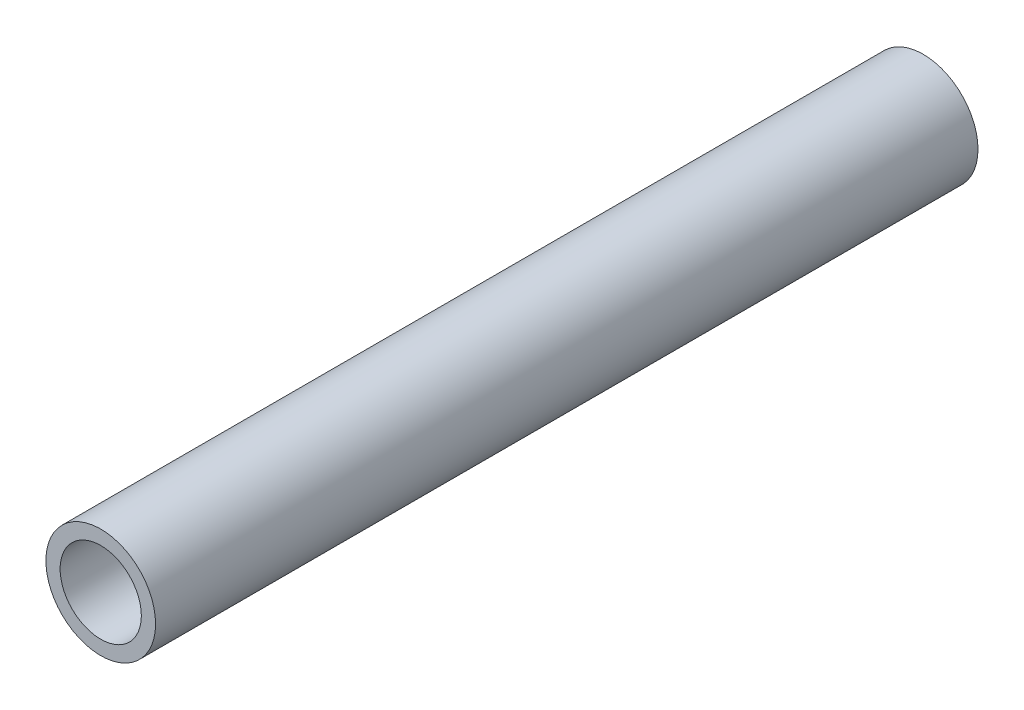
from build123d import *

# Parameters (mm, degrees)
SKETCH1_R           = 10.668
SKETCH1_R_2         = 7.8994
EXTRUDE_THIN1_DEPTH = 80


with BuildPart() as part:
    # Sketch1 → Extrude-Thin1 (new, symmetric)
    with BuildSketch(Plane.XY):
        Circle(SKETCH1_R)
        Circle(SKETCH1_R_2, mode=Mode.SUBTRACT)
    extrude(amount=EXTRUDE_THIN1_DEPTH, both=True)


solid = part.part
